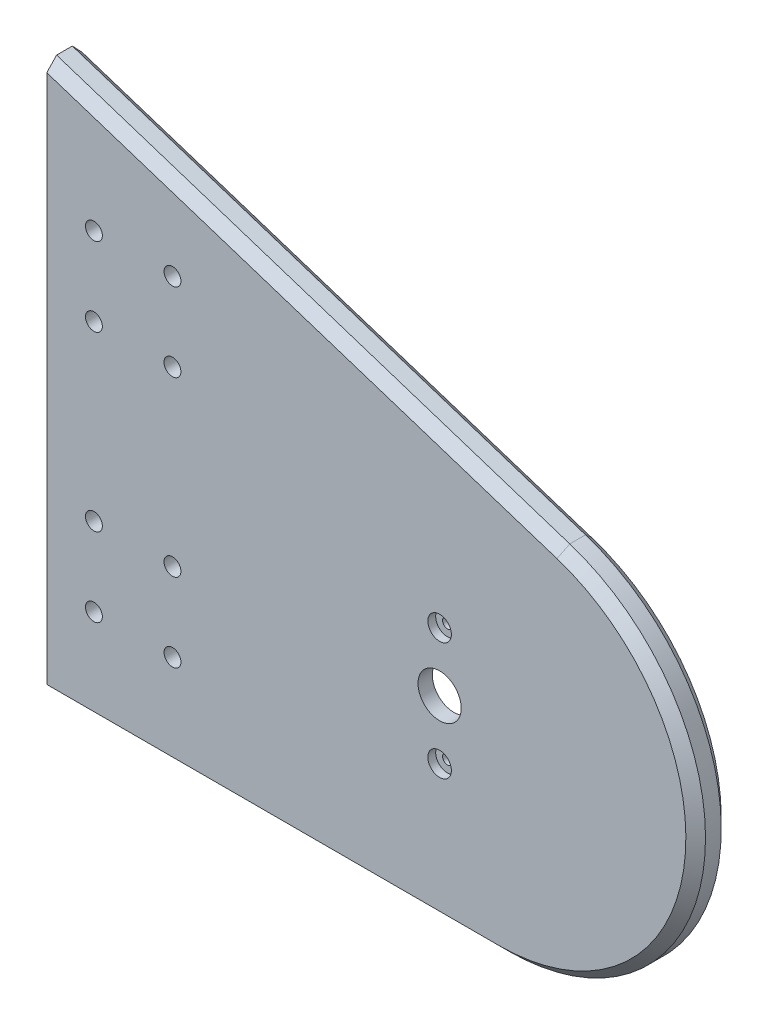
from build123d import *

# Parameters (mm, degrees)
SKETCH_1_R               = 11
EXTRUDE_1_DEPTH          = 8
FILLET_1_R               = 100
EXTRUDE_2_DEPTH          = 10
FILLET_2_R               = 10
CHAMFER_1_SIZE           = 5
SKETCH_4_R               = 13
CUT_EXTRUDE_1_DEPTH      = 0.7
SKETCH_5_R               = 2.5
CUT_EXTRUDE_2_DEPTH      = 434.184093957
SKETCH_6_R               = 6
CUT_EXTRUDE_3_DEPTH      = 4
CUT_EXTRUDE_4_DEPTH      = 434.442567426
CUT_EXTRUDE_4_DEPTH_BACK = 434.442567426
SKETCH_7_R               = 4.3


with BuildPart() as part:
    # 草图1 → 凸台-拉伸1 (new body)
    with BuildSketch(Plane.XY):
        Polygon((0, 0), (0, 280), (861.751390409, 0), align=None)
        with Locations((200, 100)):
            Circle(SKETCH_1_R, mode=Mode.SUBTRACT)
    extrude(amount=EXTRUDE_1_DEPTH)

    # 圆角1
    fillet_1_edges = [part.edges().sort_by_distance(p)[0] for p in [
        (861.751390409, 0, 4),
    ]]
    fillet(fillet_1_edges, radius=FILLET_1_R)

    # 草图2 → 凸台-拉伸2 (add)
    with BuildSketch(Plane.XY):
        with BuildLine():
            Line((0, 280), (0, 0))
            Line((0, 0), (230.376238942, 0))
            ThreePointArc((230.376238942, 0), (329.145073001, 84.356553496), (261.277938379, 195.10565163))
            Line((261.277938379, 195.10565163), (0, 280))
        make_face()
        with BuildLine():
            Line((230.376238942, 10), (30, 10))
            Line((30, 10), (151.410485182, 220.289128906))
            Line((151.410485182, 220.289128906), (258.187768435, 185.595086467))
            ThreePointArc((258.187768435, 185.595086467), (319.268189595, 85.920898146), (230.376238942, 10))
        make_face(mode=Mode.SUBTRACT)
        Polygon((10, 35.358983849), (10, 266.236180795), (122.241374643, 229.766747442), align=None, mode=Mode.SUBTRACT)
    extrude(amount=-EXTRUDE_2_DEPTH)

    # 圆角2
    fillet_2_edges = [part.edges().sort_by_distance(p)[0] for p in [
        (10, 35.358983849, -5),
        (30, 10, -5),
        (122.241374643, 229.766747442, -5),
        (151.410485182, 220.289128906, -5),
        (10, 266.236180795, -5),
    ]]
    fillet(fillet_2_edges, radius=FILLET_2_R)

    # 倒角1
    chamfer_1_edges = [part.edges().sort_by_distance(p)[0] for p in [
        (115.188119471, 0, 8),
        (130.63896919, 237.552825815, 8),
        (329.145073001, 84.356553496, 8),
        (130.63896919, 237.552825815, -10),
        (115.188119471, 0, -10),
        (329.145073001, 84.356553496, -10),
    ]]
    chamfer(chamfer_1_edges, length=CHAMFER_1_SIZE)

    # 草图4 → 切除-拉伸1 (cut)
    with BuildSketch(Plane(origin=(0, 0, 0), x_dir=(-1, 0, 0), z_dir=(0, 0, -1))):
        with Locations((-200, 100)):
            Circle(SKETCH_4_R)
    extrude(amount=-CUT_EXTRUDE_1_DEPTH, mode=Mode.SUBTRACT)

    # 草图5 → 切除-拉伸2 (cut, through all)
    with BuildSketch(Plane(origin=(0, 0, 0), x_dir=(-1, 0, 0), z_dir=(0, 0, -1))):
        with Locations((-200, 130)):
            Circle(SKETCH_5_R)
        with Locations((-200, 70)):
            Circle(SKETCH_5_R)
    extrude(amount=-CUT_EXTRUDE_2_DEPTH, mode=Mode.SUBTRACT)

    # 草图6 → 切除-拉伸3 (cut)
    with BuildSketch(Plane.XY.offset(8)):
        with Locations((200, 130)):
            Circle(SKETCH_6_R)
        with Locations((200, 70)):
            Circle(SKETCH_6_R)
    extrude(amount=-CUT_EXTRUDE_3_DEPTH, mode=Mode.SUBTRACT)

    # 草图7 → 切除-拉伸4 (cut, two sides: drawn at the far end of the back side and taken through both)
    with BuildSketch(Plane.XY.offset(8).offset(-CUT_EXTRUDE_4_DEPTH_BACK)):
        with Locations((64, 217)):
            Circle(SKETCH_7_R)
        with Locations((24, 217)):
            Circle(SKETCH_7_R)
        with Locations((64, 177)):
            Circle(SKETCH_7_R)
        with Locations((24, 177)):
            Circle(SKETCH_7_R)
        with Locations((64, 89)):
            Circle(SKETCH_7_R)
        with Locations((24, 89)):
            Circle(SKETCH_7_R)
        with Locations((64, 49)):
            Circle(SKETCH_7_R)
        with Locations((24, 49)):
            Circle(SKETCH_7_R)
    extrude(amount=CUT_EXTRUDE_4_DEPTH + CUT_EXTRUDE_4_DEPTH_BACK, mode=Mode.SUBTRACT)


solid = part.part
